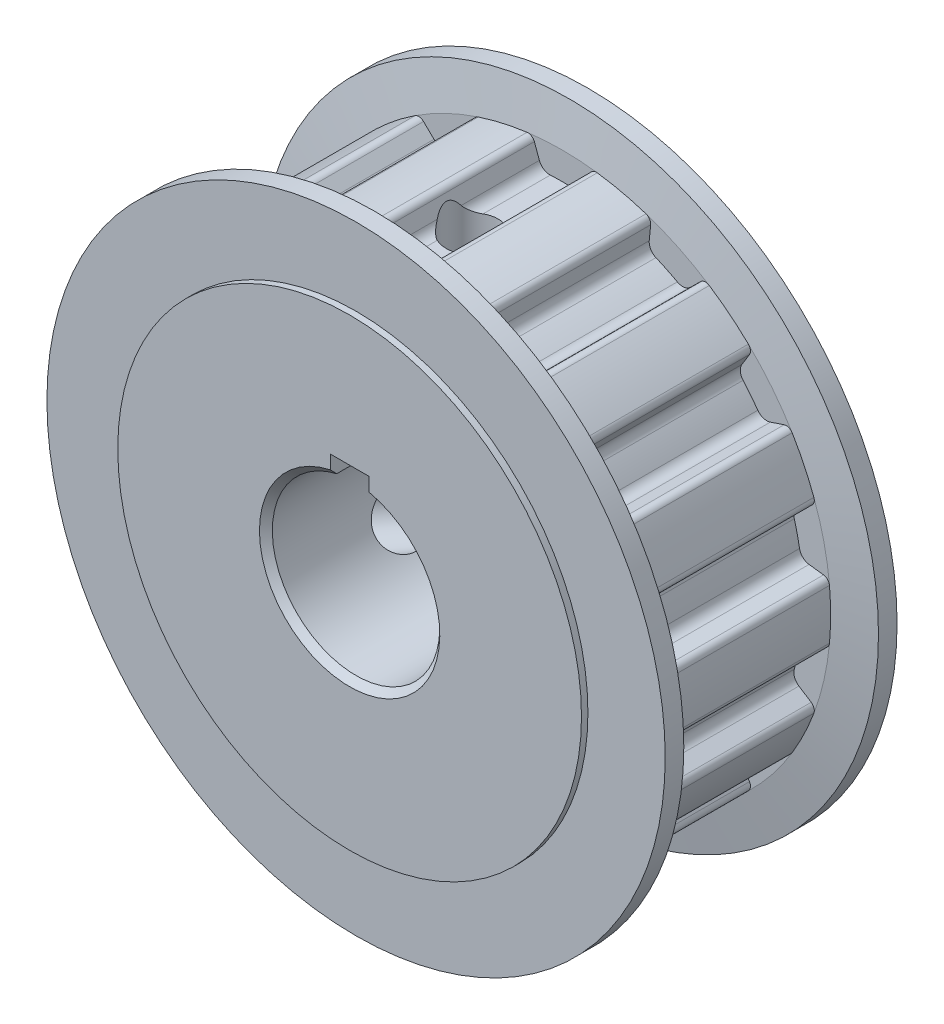
from build123d import *

# Parameters (mm, degrees)
CUT_EXTRUDE_START        = -16.5
CUT_EXTRUDE_1_DEPTH      = 14
PATTERN_CIRCULAR_1_COUNT = 14
SKETCH_3_R               = 2
CUT_EXTRUDE_2_DEPTH      = 39.897300678
PATTERN_CIRCULAR_2_COUNT = 2
PATTERN_CIRCULAR_2_ANGLE = 120
SKETCH_4_W               = 3
SKETCH_4_H               = 1.57544468
CUT_EXTRUDE_3_DEPTH      = 39.897300678


with BuildPart() as part:
    # 草图1 → 旋转1 (revolve)
    with BuildSketch(Plane(origin=(0, 0, 0), x_dir=(0, 0, -1), z_dir=(1, 0, 0)), mode=Mode.PRIVATE) as revolve_1_sk:
        Polygon((18.5, 6.5), (0.5, 6.5), (0, 7), (0, 18), (0.5, 18), (0.5, 24), (1.943688376, 24), (2.5, 20.845), (16.5, 20.845), (17.056311624, 24), (18.5, 24), (18.5, 18), (19, 18), (19, 7), align=None)
    revolve(revolve_1_sk.sketch.rotate(Axis((0, 0, 0), (0, 0, -1)), 90), axis=Axis((0, 0, 0), (0, 0, -1)))

    # 草图2 → 切除-拉伸1 (cut)
    with BuildSketch(Plane.XY.offset(CUT_EXTRUDE_START)):
        with BuildLine():
            Line((-2.158251537, 20.321860432), (-1.770739639, 19.257180243))
            ThreePointArc((-1.770739639, 19.257180243), (-1.438404026, 18.834927783), (-0.920313337, 18.69235802))
            ThreePointArc((-0.920313337, 18.69235802), (0, 18.715), (0.920313337, 18.69235802))
            ThreePointArc((0.920313337, 18.69235802), (1.438404026, 18.834927783), (1.770739639, 19.257180243))
            Line((1.770739639, 19.257180243), (2.158251537, 20.321860432))
            ThreePointArc((2.158251537, 20.321860432), (2.381391095, 20.593724778), (2.725588797, 20.666039551))
            ThreePointArc((2.725588797, 20.666039551), (0, 20.845), (-2.725588797, 20.666039551))
            ThreePointArc((-2.725588797, 20.666039551), (-2.381391095, 20.593724778), (-2.158251537, 20.321860432))
        make_face()
    cut_extrude_1 = extrude(amount=CUT_EXTRUDE_1_DEPTH, mode=Mode.SUBTRACT)

    # 阵列(圆周)1: 切除-拉伸1 ×14 about axis
    pattern_circular_1_axis = Axis((0, 0, 0), (0, 0, 1))
    for i in range(1, PATTERN_CIRCULAR_1_COUNT):
        add(cut_extrude_1.rotate(pattern_circular_1_axis, i * 360 / PATTERN_CIRCULAR_1_COUNT), mode=Mode.SUBTRACT)

    # 草图3 → 切除-拉伸2 (cut, through all)
    with BuildSketch(Plane(origin=(0, 0, 0), x_dir=(1, 0, 0), z_dir=(0, 1, 0))):
        with Locations(Location((0, 9.5, 0), (0, 0, 90))):
            Circle(SKETCH_3_R)
    cut_extrude_2 = extrude(amount=CUT_EXTRUDE_2_DEPTH, mode=Mode.SUBTRACT)

    # 阵列(圆周)2: 切除-拉伸2 ×2 about axis
    pattern_circular_2_axis = Axis((0, 0, 0), (0, 0, 1))
    for i in range(1, PATTERN_CIRCULAR_2_COUNT):
        add(cut_extrude_2.rotate(pattern_circular_2_axis, i * PATTERN_CIRCULAR_2_ANGLE / (PATTERN_CIRCULAR_2_COUNT - 1)), mode=Mode.SUBTRACT)

    # 草图4 → 切除-拉伸3 (cut, through all)
    with BuildSketch(Plane.XY):
        with Locations((0, 7.11227766)):
            Rectangle(SKETCH_4_W, SKETCH_4_H)
    extrude(amount=-CUT_EXTRUDE_3_DEPTH, mode=Mode.SUBTRACT)


solid = part.part
